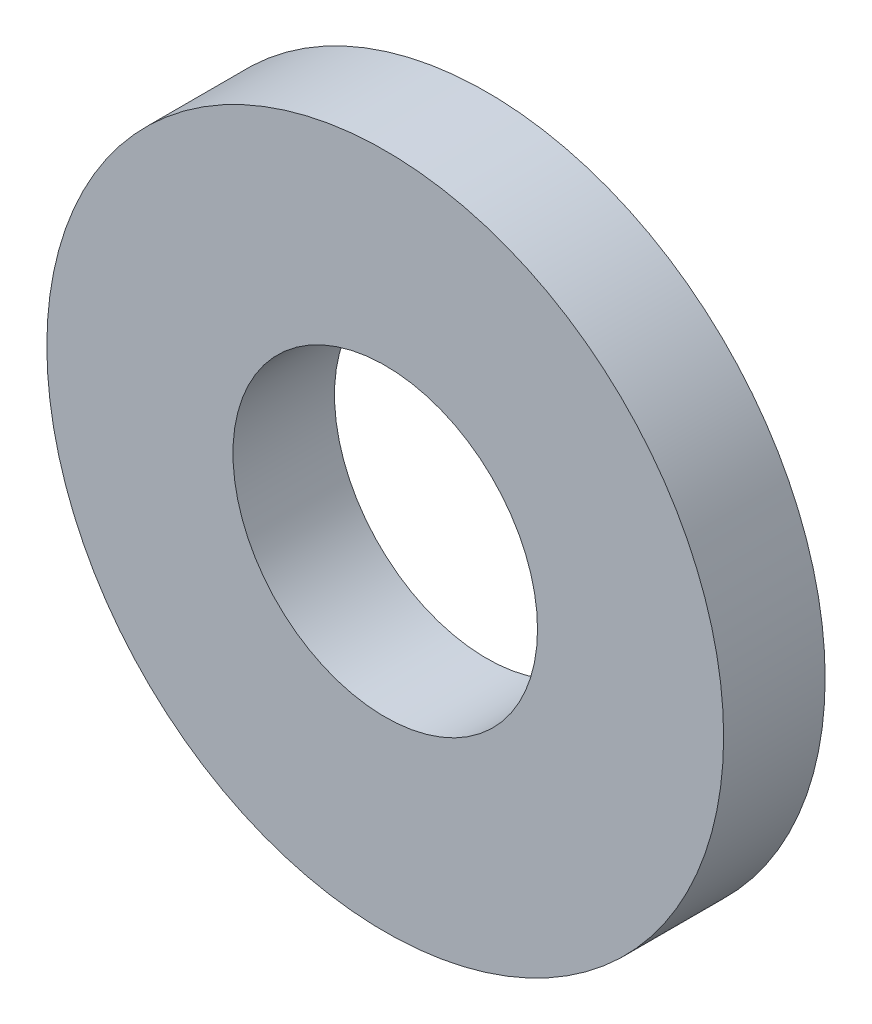
from build123d import *

# Parameters (mm, degrees)
SKETCH_1_R      = 5
SKETCH_1_R_2    = 2.25
EXTRUDE_1_DEPTH = 1.5


with BuildPart() as part:
    # 스케치1 → 보스-돌출1 (new body)
    with BuildSketch(Plane.XY):
        Circle(SKETCH_1_R)
        Circle(SKETCH_1_R_2, mode=Mode.SUBTRACT)
    extrude(amount=EXTRUDE_1_DEPTH)


solid = part.part
